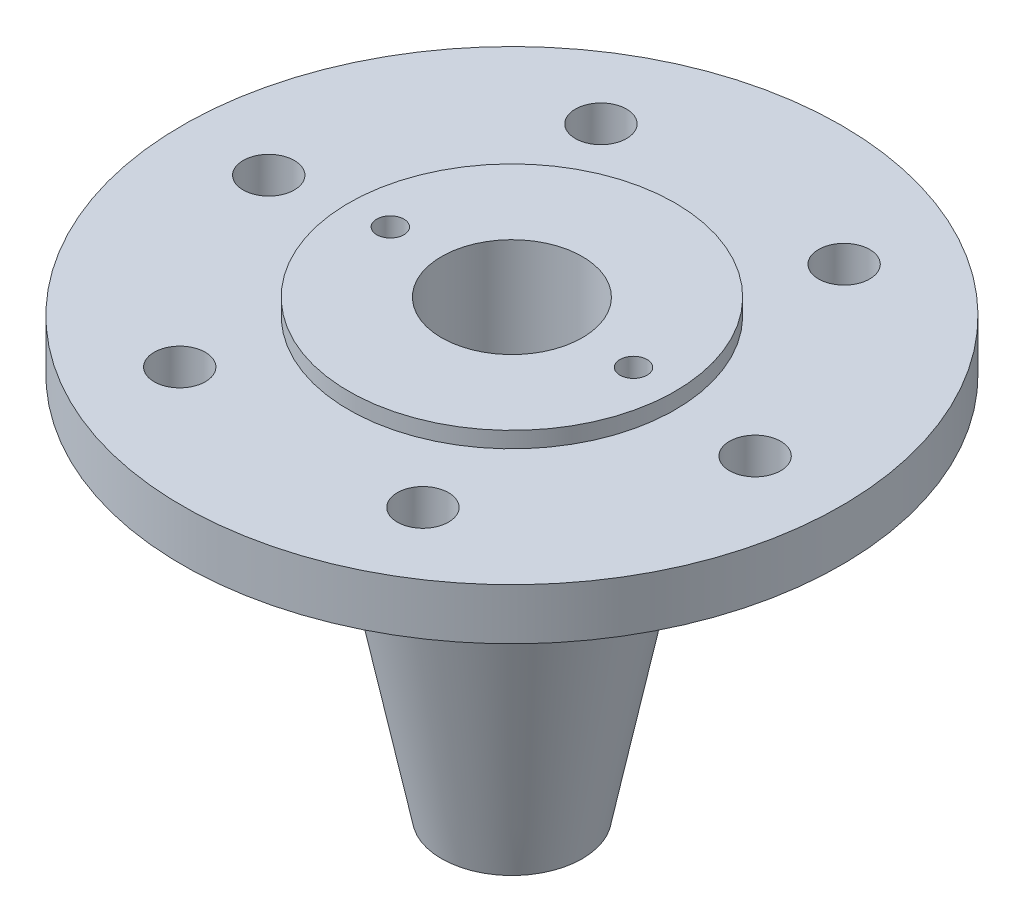
from build123d import *

# Parameters (mm, degrees)
RACCORDO1_R                    = 5
FORO_1_0_16_1_D                = 16
RIPETIZIONECIRCOLARE1_COUNT    = 6
FORO_FILETTATO_M10X1_5_1_D     = 8.5
FORO_FILETTATO_M10X1_5_1_DEPTH = 18
FORO_FILETTATO_M10X1_5_1_TIP   = 2.553657631


with BuildPart() as part:
    # Schizzo1 → Rivoluzione1 (revolve)
    with BuildSketch(Plane.XY, mode=Mode.PRIVATE) as rivoluzione1_sk:
        Polygon((0, 0), (51, 0), (51, -5), (103, -5), (103, -21), (54, -21), (54, -31), (44, -31), (22, -141), (0, -141), align=None)
    revolve(rivoluzione1_sk.sketch.rotate(Axis((0, -141, 0), (0, 1, 0)), 90), axis=Axis((0, -141, 0), (0, 1, 0)))

    # Schizzo2 → Taglia-Rivoluzione1 (revolve, cut)
    with BuildSketch(Plane.XY, mode=Mode.PRIVATE) as taglia_rivoluzione1_sk:
        Polygon((0, -141), (-11.75, -141), (-11.75, -103), (-16, -100.240017729), (-16, -86.247037966), (-11, -83), (-11, -51.143483525), (-22, -44), (-22, 0), (0, 0), align=None)
    revolve(taglia_rivoluzione1_sk.sketch.rotate(Axis((0, 0, 0), (0, -1, 0)), 270), axis=Axis((0, 0, 0), (0, -1, 0)), mode=Mode.SUBTRACT)

    # Raccordo1
    raccordo1_edges = [part.edges().sort_by_distance(p)[0] for p in [
        (0, -31, 44),
    ]]
    fillet(raccordo1_edges, radius=RACCORDO1_R)

    # Foro Ø1.0 (16)-1 (through all)
    with Locations(Plane(origin=(0, -5, 0), x_dir=(1, 0, 0), z_dir=(0, 1, 0))):
        with Locations((-76, 0)):
            foro_1_0_16_1 = Hole(FORO_1_0_16_1_D / 2)

    # RipetizioneCircolare1: Foro Ø1.0 (16)-1 ×6 about axis
    ripetizionecircolare1_axis = Axis((0, 0, 0), (0, 1, 0))
    for i in range(1, RIPETIZIONECIRCOLARE1_COUNT):
        add(foro_1_0_16_1.rotate(ripetizionecircolare1_axis, i * 360 / RIPETIZIONECIRCOLARE1_COUNT), mode=Mode.SUBTRACT)

    # Foro filettato M10x1.5-1
    with Locations(Plane(origin=(0, 0, 0), x_dir=(1, 0, 0), z_dir=(0, 1, 0))):
        with Locations((38, 0), (-38, 0)):
            Hole(FORO_FILETTATO_M10X1_5_1_D / 2, depth=FORO_FILETTATO_M10X1_5_1_DEPTH)
            with Locations((0, 0, -(FORO_FILETTATO_M10X1_5_1_DEPTH + FORO_FILETTATO_M10X1_5_1_TIP / 2))):  # 118° drill point
                Cone(0, FORO_FILETTATO_M10X1_5_1_D / 2, FORO_FILETTATO_M10X1_5_1_TIP, mode=Mode.SUBTRACT)


solid = part.part
